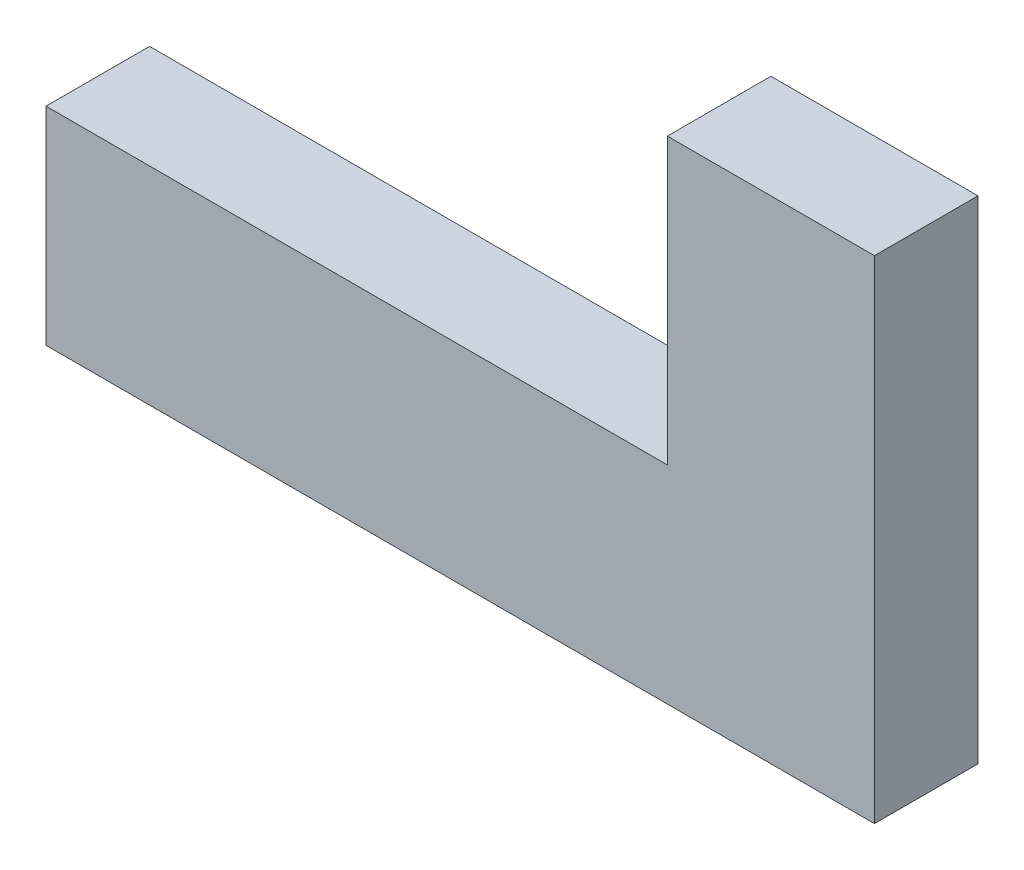
from build123d import *

# Parameters (mm, degrees)
BOSS_EXTRUDE1_DEPTH = 5.08


with BuildPart() as part:
    # Sketch1 → Boss-Extrude1 (new body)
    with BuildSketch(Plane.XY):
        Polygon((0, 10.16), (30.48, 10.16), (30.48, 24.13), (40.64, 24.13), (40.64, 10.16), (40.64, 0), (0, 0), align=None)
    extrude(amount=BOSS_EXTRUDE1_DEPTH)


solid = part.part
